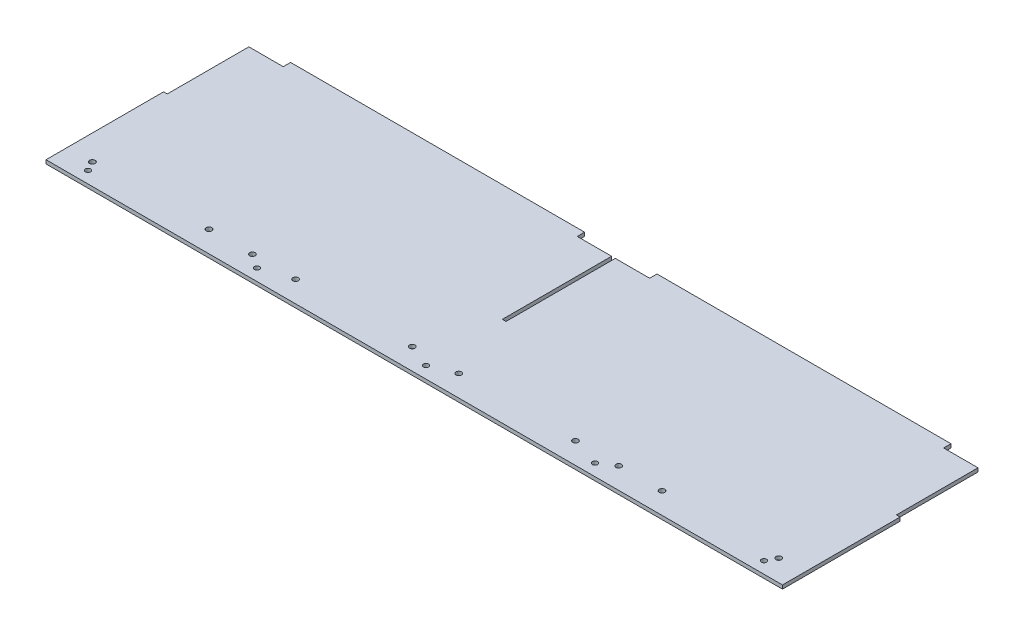
from build123d import *

# Parameters (mm, degrees)
SKETCH1_W            = 636.25984
SKETCH1_H            = 172.09262
BOSS_EXTRUDE1_DEPTH  = 3.175
SKETCH2_W            = 3.175
SKETCH2_H            = 3.175
CUT_EXTRUDE1_DEPTH   = 94.36608
SKETCH3_W            = 3.175
SKETCH3_H            = 3.175
CUT_EXTRUDE5_DEPTH   = 70.49262
SKETCH4_W            = 636.25984
SKETCH4_H            = 24.39416
CUT_EXTRUDE6_DEPTH   = 660.130134708
SKETCH6_W            = 636.25984
SKETCH6_H            = 24.39416
BOSS_EXTRUDE2_DEPTH  = 3.175
SKETCH7_W            = 254
SKETCH7_H            = 3.175
BOSS_EXTRUDE3_DEPTH  = 6.35
SKETCH8_R            = 2.25
CUT_EXTRUDE7_DEPTH   = 661.816489847
M4_CLEARANCE_HOLE1_D = 4.8


with BuildPart() as part:
    # Sketch1 → Boss-Extrude1 (new body)
    with BuildSketch(Plane(origin=(0, 0, 0), x_dir=(1, 0, 0), z_dir=(0, 1, 0))):
        with Locations((318.12992, 86.04631)):
            Rectangle(SKETCH1_W, SKETCH1_H)
    extrude(amount=BOSS_EXTRUDE1_DEPTH)

    # Sketch2 → Cut-Extrude1 (cut)
    with BuildSketch(Plane(origin=(0, 0, -172.09262), x_dir=(-1, 0, 0), z_dir=(0, 0, -1))):
        with Locations((-318.12992, 1.5875)):
            Rectangle(SKETCH2_W, SKETCH2_H)
    extrude(amount=-CUT_EXTRUDE1_DEPTH, mode=Mode.SUBTRACT)

    # Sketch3 → Cut-Extrude5 (cut)
    with BuildSketch(Plane.XY.offset(-172.09262)):
        with Locations((1.5875, 1.5875)):
            Rectangle(SKETCH3_W, SKETCH3_H)
        with Locations((634.67234, 1.5875)):
            Rectangle(SKETCH3_W, SKETCH3_H)
    extrude(amount=CUT_EXTRUDE5_DEPTH, mode=Mode.SUBTRACT)

    # Sketch4 → Cut-Extrude6 (cut, through all)
    with BuildSketch(Plane(origin=(0, 3.175, 0), x_dir=(1, 0, 0), z_dir=(0, 1, 0))):
        with Locations((318.12992, 12.19708)):
            Rectangle(SKETCH4_W, SKETCH4_H)
    extrude(amount=-CUT_EXTRUDE6_DEPTH, mode=Mode.SUBTRACT)

    # Sketch6 → Boss-Extrude2 (add, through all)
    with BuildSketch(Plane(origin=(0, 3.175, 0), x_dir=(1, 0, 0), z_dir=(0, 1, 0))):
        with Locations((318.12992, 12.19708)):
            Rectangle(SKETCH6_W, SKETCH6_H)
    extrude(amount=-BOSS_EXTRUDE2_DEPTH)

    # Sketch7 → Boss-Extrude3 (add)
    with BuildSketch(Plane(origin=(0, 0, -172.09262), x_dir=(-1, 0, 0), z_dir=(0, 0, -1))):
        with Locations((-476.40113, 1.5875)):
            Rectangle(SKETCH7_W, SKETCH7_H)
        with Locations((-159.85871, 1.5875)):
            Rectangle(SKETCH7_W, SKETCH7_H)
    extrude(amount=BOSS_EXTRUDE3_DEPTH)

    # Sketch8 → Cut-Extrude7 (cut, through all)
    with BuildSketch(Plane(origin=(0, 3.175, 0), x_dir=(1, 0, 0), z_dir=(0, 1, 0))):
        with Locations(Location((26.107106781, 10.16, 0), (0, 0, 270))):
            Circle(SKETCH8_R)
        with Locations(Location((172.118513391, 10.16, 0), (0, 0, 270))):
            Circle(SKETCH8_R)
        with Locations(Location((318.12992, 10.16, 0), (0, 0, 270))):
            Circle(SKETCH8_R)
        with Locations(Location((464.141326609, 10.16, 0), (0, 0, 270))):
            Circle(SKETCH8_R)
        with Locations(Location((610.152733219, 10.16, 0), (0, 0, 270))):
            Circle(SKETCH8_R)
    extrude(amount=-CUT_EXTRUDE7_DEPTH, mode=Mode.SUBTRACT)

    # M4 Clearance Hole1 (through all)
    with Locations(Plane(origin=(0, 3.175, 0), x_dir=(1, 0, 0), z_dir=(0, 1, 0))):
        with Locations((21.682533496, 18.397319949), (122.433944248, 18.397319949), (159.85871, 18.397319949), (197.283475752, 18.397319949), (298.034886505, 18.397319949), (338.224953495, 18.397319949), (438.976364248, 18.397319949), (476.40113, 18.397319949), (513.825895752, 18.397319949), (614.577306504, 18.397319949)):
            Hole(M4_CLEARANCE_HOLE1_D / 2)


solid = part.part
